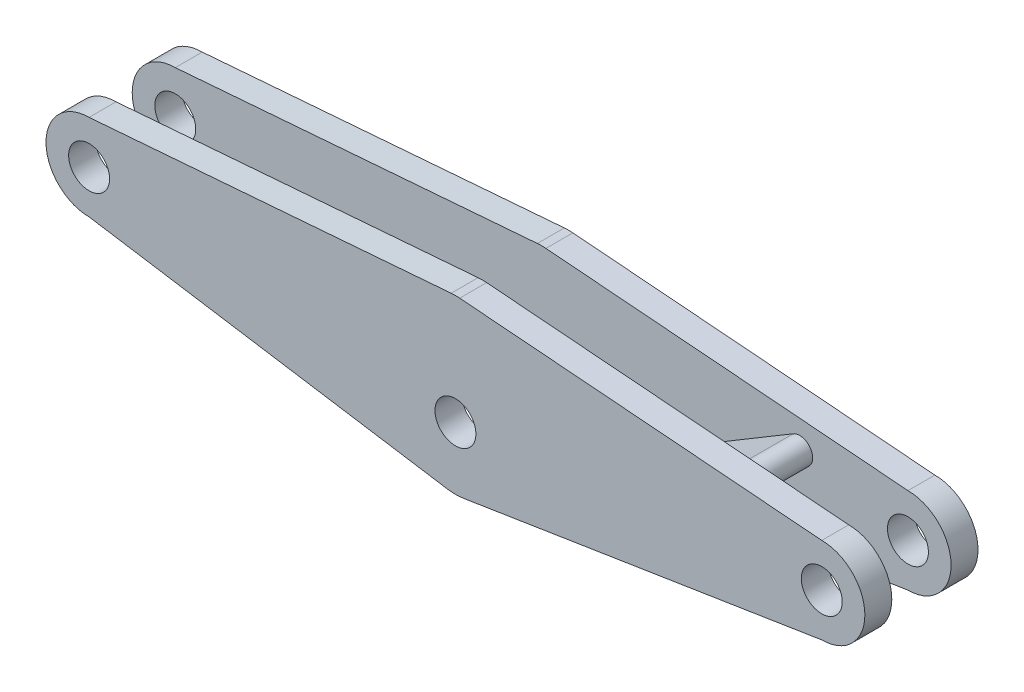
from build123d import *

# Parameters (mm, degrees)
SKETCH1_R           = 0.95
BOSS_EXTRUDE1_DEPTH = 2.625
SKETCH2_W           = 37.893298516
SKETCH2_H           = 2.75
CUT_EXTRUDE1_DEPTH  = 13.625
BOSS_EXTRUDE2_DEPTH = 5.25


with BuildPart() as part:
    # Sketch1 → Boss-Extrude1 (new, symmetric)
    with BuildSketch(Plane.XY):
        with BuildLine():
            Line((17, 2), (0.197906371, 3.334283906))
            ThreePointArc((0.197906371, 3.334283906), (0, 3.342129603), (-0.197906371, 3.334283906))
            Line((-0.197906371, 3.334283906), (-17, 2))
            ThreePointArc((-17, 2), (-19, 0), (-17, -2))
            Line((-17, -2), (-0.389436602, -4.619481551))
            ThreePointArc((-0.389436602, -4.619481551), (0, -4.65), (0.389436602, -4.619481551))
            Line((0.389436602, -4.619481551), (17, -2))
            ThreePointArc((17, -2), (19, 0), (17, 2))
        make_face()
        with Locations(Location((-17, 0, 0), (0, 0, 180))):
            Circle(SKETCH1_R, mode=Mode.SUBTRACT)
        with Locations(Location((17, 0, 0), (0, 0, 180))):
            Circle(SKETCH1_R, mode=Mode.SUBTRACT)
        with Locations(Location((0, -1.75, 0), (0, 0, 180))):
            Circle(SKETCH1_R, mode=Mode.SUBTRACT)
    extrude(amount=BOSS_EXTRUDE1_DEPTH, both=True)

    # Sketch2 → Cut-Extrude1 (cut, symmetric)
    with BuildSketch(Plane(origin=(0.264362283, 3.329006525, 0), x_dir=(0.996861721065102, -0.07916254843752263, 0), z_dir=(0.07916254843752263, 0.996861721065102, 0))):
        Rectangle(SKETCH2_W, SKETCH2_H)
    extrude(amount=CUT_EXTRUDE1_DEPTH, both=True, mode=Mode.SUBTRACT)


with BuildPart() as cut_extrude1_piece_1:
    # of the separate pieces the step leaves, piece 1, a body of its own (cut_extrude1_pieces)
    add(part.part.solids().sort_by_distance((17, 2, 2.625))[0])



with BuildPart() as cut_extrude1_piece_2:
    # of the separate pieces the step leaves, piece 2, a body of its own (cut_extrude1_pieces)
    add(part.part.solids().sort_by_distance((17, 2, -1.375))[0])


with BuildPart() as cut_extrude1_piece_1_1:
    add(cut_extrude1_piece_1.part)

    add(cut_extrude1_piece_2.part)  # Boss-Extrude2 merges Cut-Extrude1 piece 2
    # Sketch3 → Boss-Extrude2 (add)
    with BuildSketch(Plane.XY.offset(2.625)):
        with BuildLine():
            Line((6.692125271, -1.355773858), (11.670347401, 1.620348522))
            ThreePointArc((11.670347401, 1.620348522), (12.493210627, 1.413234754), (12.286096859, 0.590371529))
            Line((12.286096859, 0.590371529), (7.307874729, -2.385750851))
            ThreePointArc((7.307874729, -2.385750851), (6.485011504, -2.178637083), (6.692125271, -1.355773858))
        make_face()
    extrude(amount=-BOSS_EXTRUDE2_DEPTH)


solid = cut_extrude1_piece_1_1.part
